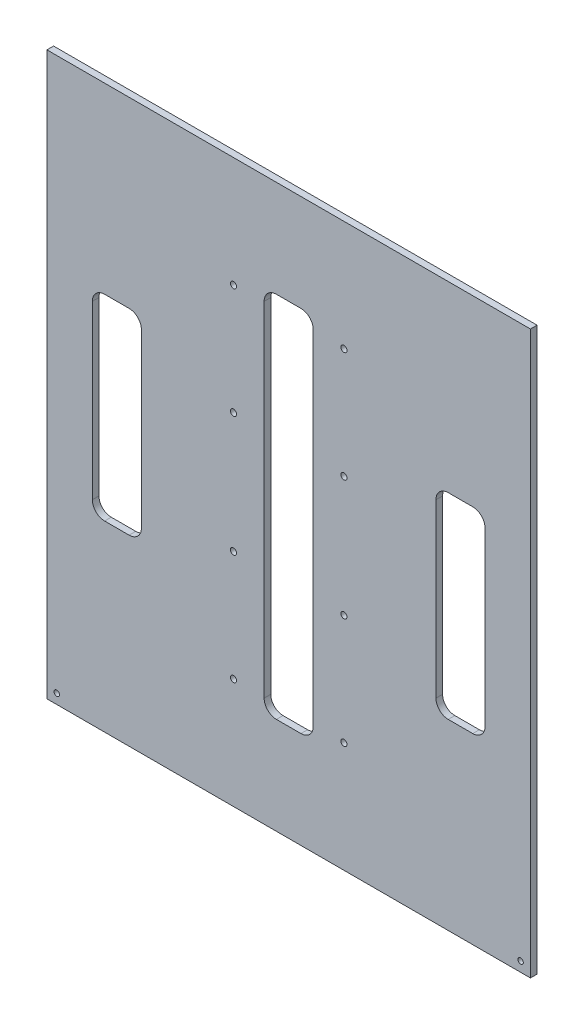
from build123d import *

# Parameters (mm, degrees)
SKETCH_1_W          = 197
SKETCH_1_H          = 229
EXTRUDE_1_DEPTH     = 2.7
SKETCH_2_R          = 1.1
CUT_EXTRUDE_1_DEPTH = 2.85
SKETCH_6_W          = 20
SKETCH_6_H          = 80
SKETCH_6_H_2        = 150
CUT_EXTRUDE_4_DEPTH = 10
FILLET_1_R          = 5
SKETCH_7_R          = 1.25
CUT_EXTRUDE_5_DEPTH = 10


with BuildPart() as part:
    # 草图1 → 凸台-拉伸1 (new body)
    with BuildSketch(Plane.XY):
        with Locations((98.5, 114.5)):
            Rectangle(SKETCH_1_W, SKETCH_1_H)
    extrude(amount=EXTRUDE_1_DEPTH)

    # 草图2 → 切除-拉伸1 (cut)
    with BuildSketch(Plane.XY.offset(2.7)):
        with Locations((4, 4)):
            Circle(SKETCH_2_R)
        with Locations((193, 4)):
            Circle(SKETCH_2_R)
    extrude(amount=-CUT_EXTRUDE_1_DEPTH, mode=Mode.SUBTRACT)

    # 草图6 → 切除-拉伸4 (cut)
    with BuildSketch(Plane(origin=(0, 0, 0), x_dir=(-1, 0, 0), z_dir=(0, 0, -1))):
        with Locations((-168.5, 114.5)):
            Rectangle(SKETCH_6_W, SKETCH_6_H)
        with Locations((-28.5, 114.5)):
            Rectangle(SKETCH_6_W, SKETCH_6_H)
        with Locations((-98.5, 114.5)):
            Rectangle(SKETCH_6_W, SKETCH_6_H_2)
    extrude(amount=-CUT_EXTRUDE_4_DEPTH, mode=Mode.SUBTRACT)

    # 圆角1
    fillet_1_edges = [part.edges().sort_by_distance(p)[0] for p in [
        (178.5, 74.5, 1.35),
        (178.5, 154.5, 1.35),
        (158.5, 154.5, 1.35),
        (158.5, 74.5, 1.35),
        (38.5, 74.5, 1.35),
        (38.5, 154.5, 1.35),
        (18.5, 154.5, 1.35),
        (18.5, 74.5, 1.35),
        (108.5, 39.5, 1.35),
        (108.5, 189.5, 1.35),
        (88.5, 189.5, 1.35),
        (88.5, 39.5, 1.35),
    ]]
    fillet(fillet_1_edges, radius=FILLET_1_R)

    # 草图7 → 切除-拉伸5 (cut)
    with BuildSketch(Plane.XY.offset(2.7)):
        with Locations((76, 184)):
            Circle(SKETCH_7_R)
        with Locations((121, 184)):
            Circle(SKETCH_7_R)
        with Locations((76, 139)):
            Circle(SKETCH_7_R)
        with Locations((121, 139)):
            Circle(SKETCH_7_R)
        with Locations(Location((121, 90, 0), (0, 0, 180))):
            Circle(SKETCH_7_R)
        with Locations(Location((76, 90, 0), (0, 0, 180))):
            Circle(SKETCH_7_R)
        with Locations(Location((121, 45, 0), (0, 0, 180))):
            Circle(SKETCH_7_R)
        with Locations(Location((76, 45, 0), (0, 0, 180))):
            Circle(SKETCH_7_R)
    extrude(amount=-CUT_EXTRUDE_5_DEPTH, mode=Mode.SUBTRACT)


solid = part.part
